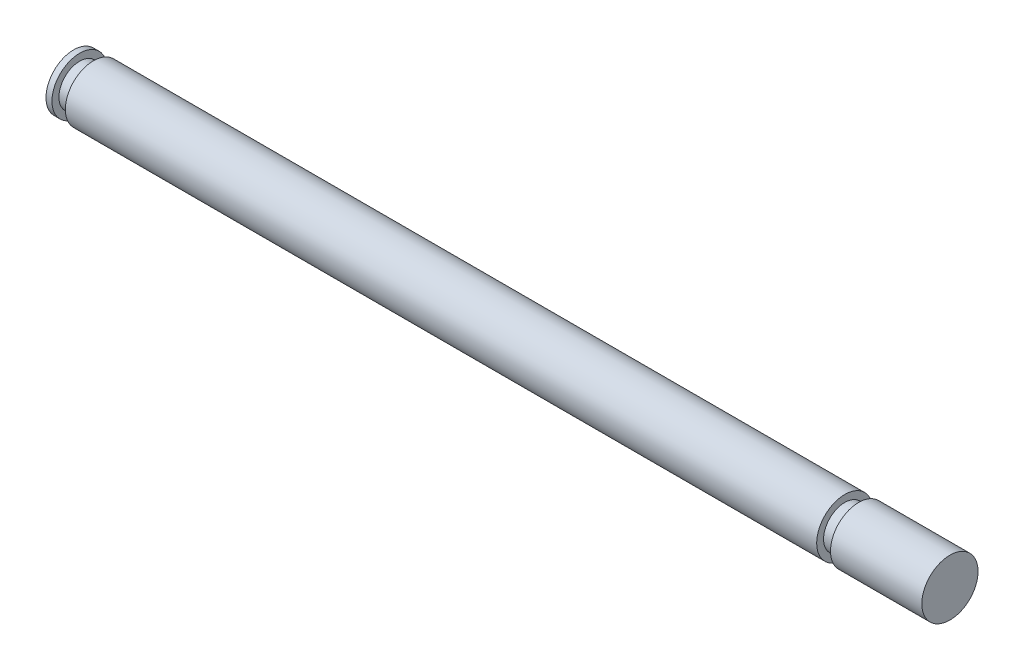
from build123d import *


with BuildPart() as part:
    # Sketch1 → Revolve1 (revolve)
    with BuildSketch(Plane.XY, mode=Mode.PRIVATE) as revolve1_sk:
        Polygon((0, 0), (0, 50), (10.8, 50), (10.8, 37.5), (35.8, 37.5), (35.8, 50.831773459), (1393.1, 50.831773459), (1393.1, 38.331773459), (1418.1, 38.331773459), (1418.1, 50.831773459), (1583, 50.831773459), (1583, 0), align=None)
    revolve(revolve1_sk.sketch.rotate(Axis((0, 0, 0), (1, 0, 0)), 90), axis=Axis((0, 0, 0), (1, 0, 0)))


solid = part.part
